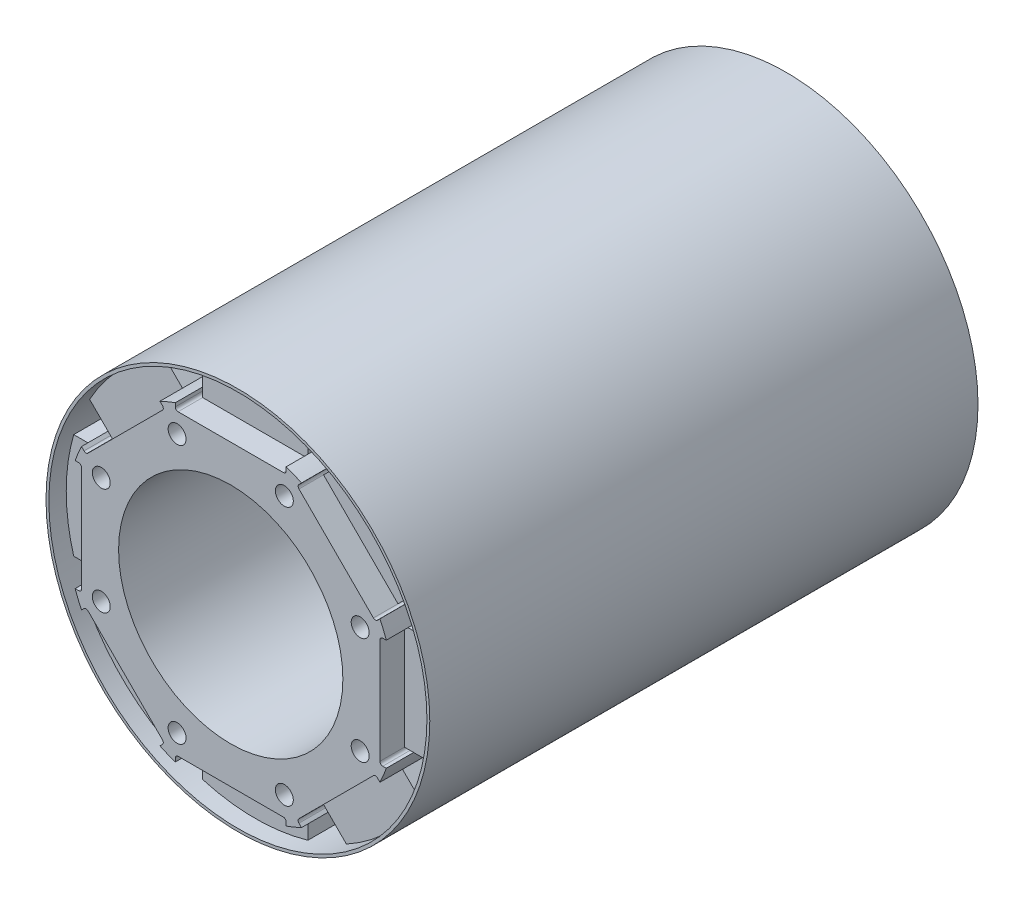
from build123d import *

# Parameters (mm, degrees)
SKETCH_1_R                       = 14.735
SKETCH_1_R_2                     = 10.005
EXTRUDE_1_DEPTH                  = 50.19
CUT_EXTRUDE_START                = 42
CUT_EXTRUDE_1_DEPTH              = 94.586205036
FILLET_1_R                       = 0.25
PATTERN_CIRCULAR_2_COUNT         = 8
FILLET_1_OF_PATTERN_CIRCULAR_2_R = 0.25
EXTRUDE_2_DEPTH                  = 45
PATTERN_CIRCULAR_4_COUNT         = 8
SKETCH_5_R                       = 17.12
SKETCH_5_R_2                     = 16.865
EXTRUDE_3_DEPTH                  = 48.91
PATTERN_CIRCULAR_6_COUNT         = 8


with BuildPart() as part:
    # 草图1 → 凸台-拉伸1 (new body)
    with BuildSketch(Plane.XY):
        with Locations(Location((0, 0, 0), (0, 0, 180))):
            Circle(SKETCH_1_R)
        with Locations(Location((0, 0, 0), (0, 0, 180))):
            Circle(SKETCH_1_R_2, mode=Mode.SUBTRACT)
    extrude(amount=EXTRUDE_1_DEPTH)

    # 草图3 → 切除-拉伸1 (cut)
    with BuildSketch(Plane(origin=(0, 0, 3), x_dir=(-1, 0, 0), z_dir=(0, 0, -1)).offset(CUT_EXTRUDE_START)):
        with BuildLine():
            Line((-4.9475, 13.879570193), (-4.9475, 13.31))
            Line((-4.9475, 13.31), (4.9475, 13.31))
            Line((4.9475, 13.31), (4.9475, 13.879570193))
            ThreePointArc((4.9475, 13.879570193), (0, 14.735), (-4.9475, 13.879570193))
        make_face()
    cut_extrude_1 = extrude(amount=-CUT_EXTRUDE_1_DEPTH, mode=Mode.SUBTRACT)

    # 圆角1
    fillet_1_edges = [part.edges().sort_by_distance(p)[0] for p in [
        (4.9475, 13.31, 25.095),
        (-4.9475, 13.31, 25.095),
    ]]
    fillet(fillet_1_edges, radius=FILLET_1_R)

    # 阵列(圆周)2: 切除-拉伸1 ×8 about axis
    pattern_circular_2_axis = Axis((0, 0, 0), (0, 0, 1))
    for i in range(1, PATTERN_CIRCULAR_2_COUNT):
        add(cut_extrude_1.rotate(pattern_circular_2_axis, i * 360 / PATTERN_CIRCULAR_2_COUNT), mode=Mode.SUBTRACT)

    # 圆角1 of 阵列(圆周)2
    fillet_1_of_pattern_circular_2_edges = [part.edges().sort_by_distance(p)[0] for p in [
        (-5.913180458, 12.910002058, 25.095),
        (-12.910002058, 5.913180458, 25.095),
        (-13.31, 4.9475, 25.095),
        (-13.31, -4.9475, 25.095),
        (-12.910002058, -5.913180458, 25.095),
        (-5.913180458, -12.910002058, 25.095),
        (-4.9475, -13.31, 25.095),
        (4.9475, -13.31, 25.095),
        (5.913180458, -12.910002058, 25.095),
        (12.910002058, -5.913180458, 25.095),
        (13.31, -4.9475, 25.095),
        (13.31, 4.9475, 25.095),
        (12.910002058, 5.913180458, 25.095),
        (5.913180458, 12.910002058, 25.095),
    ]]
    fillet(fillet_1_of_pattern_circular_2_edges, radius=FILLET_1_OF_PATTERN_CIRCULAR_2_R)

    # 草图4 → 凸台-拉伸2 (add)
    with BuildSketch(Plane(origin=(0, 0, 3), x_dir=(-1, 0, 0), z_dir=(0, 0, -1))):
        with BuildLine():
            Line((-4.6975, 13.31), (-4.6975, 16.197583732))
            ThreePointArc((-4.6975, 16.197583732), (0, 16.865), (4.6975, 16.197583732))
            Line((4.6975, 16.197583732), (4.6975, 13.31))
            Line((4.6975, 13.31), (-4.6975, 13.31))
        make_face()
    extrude_2 = extrude(amount=-EXTRUDE_2_DEPTH)

    # 阵列(圆周)4: 凸台-拉伸2 ×8 about axis
    pattern_circular_4_axis = Axis((0, 0, 0), (0, 0, 1))
    for i in range(1, PATTERN_CIRCULAR_4_COUNT):
        add(extrude_2.rotate(pattern_circular_4_axis, i * 360 / PATTERN_CIRCULAR_4_COUNT))

    # 草图5 → 凸台-拉伸3 (add)
    with BuildSketch(Plane(origin=(0, 0, 0.64), x_dir=(-1, 0, 0), z_dir=(0, 0, -1))):
        Circle(SKETCH_5_R)
        Circle(SKETCH_5_R_2, mode=Mode.SUBTRACT)
    extrude(amount=-EXTRUDE_3_DEPTH)

    # 草图9 → M2 螺纹孔2 (revolve, cut)
    with BuildSketch(Plane(origin=(-4.783542905, 11.548494156, 50.19), x_dir=(0, -1, 0), z_dir=(1, 0, 0))):
        Polygon((0, 0), (0, 5.680688495), (0.8, 5.2), (0.8, 0), align=None)
    hole_wizard_m2_2 = revolve(axis=Axis((-4.783542905, 11.548494156, 56.54), (0, 0, -1)), mode=Mode.SUBTRACT)

    # 阵列(圆周)6: M2 螺纹孔2 ×8 about axis
    pattern_circular_6_axis = Axis((0, 0, 0), (0, 0, 1))
    for i in range(1, PATTERN_CIRCULAR_6_COUNT):
        add(hole_wizard_m2_2.rotate(pattern_circular_6_axis, i * 360 / PATTERN_CIRCULAR_6_COUNT), mode=Mode.SUBTRACT)


solid = part.part
